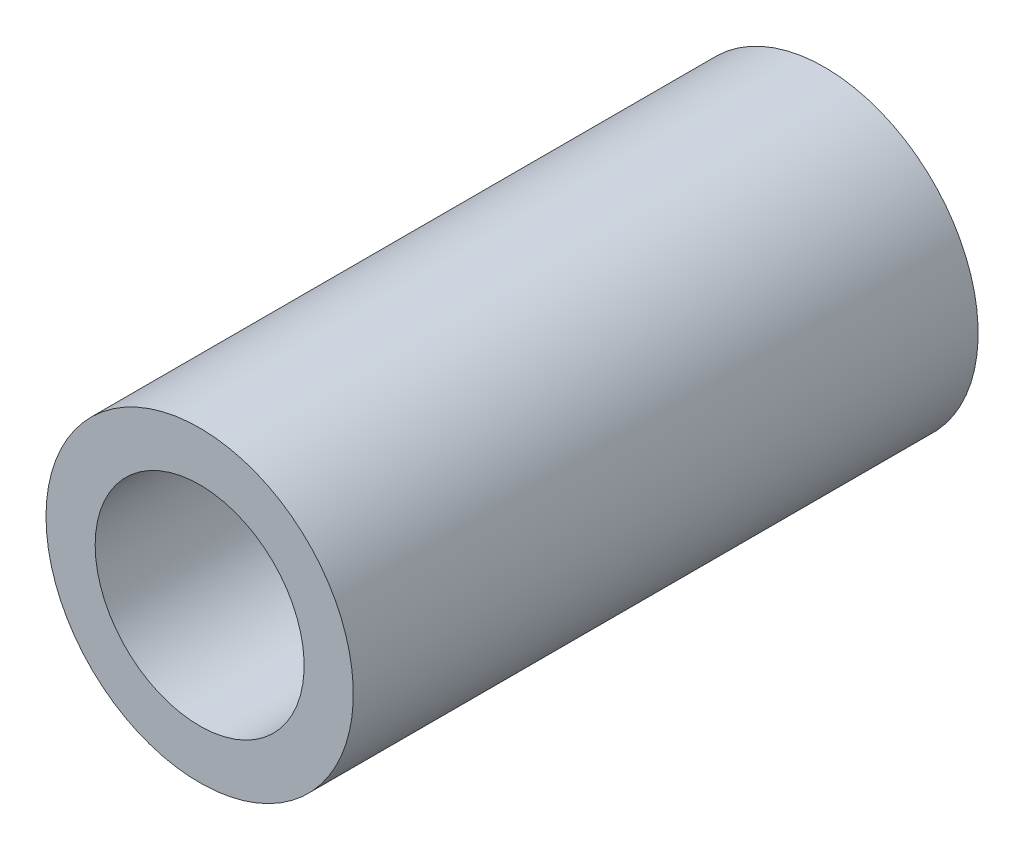
from build123d import *

# Parameters (mm, degrees)
SKETCH_1_R      = 7.5
SKETCH_1_R_2    = 5.1
EXTRUDE_1_DEPTH = 30.5


with BuildPart() as part:
    # 草图1 → 凸台-拉伸1 (new body)
    with BuildSketch(Plane.XY):
        with Locations(Location((0, 0, 0), (0, 0, 180))):
            Circle(SKETCH_1_R)
        with Locations(Location((0, 0, 0), (0, 0, 180))):
            Circle(SKETCH_1_R_2, mode=Mode.SUBTRACT)
    extrude(amount=EXTRUDE_1_DEPTH)


solid = part.part
